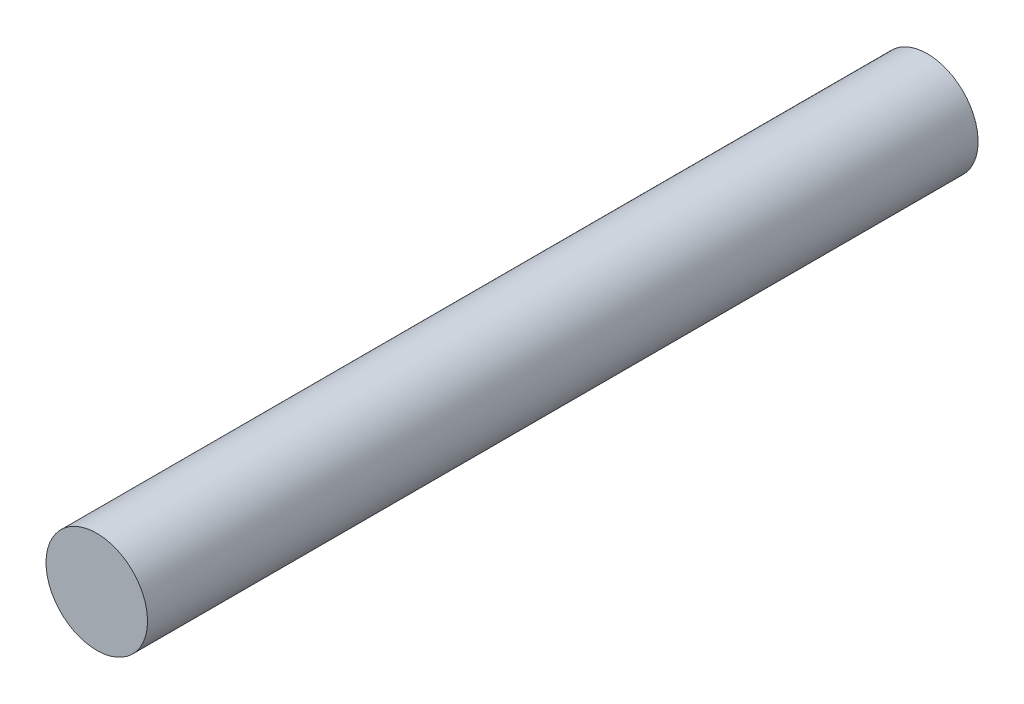
from build123d import *

# Parameters (mm, degrees)
CROQUIS1_R              = 2.75
SALIENTE_EXTRUIR1_DEPTH = 45


with BuildPart() as part:
    # Croquis1 → Saliente-Extruir1 (new body)
    with BuildSketch(Plane.XY):
        with Locations(Location((0, 0, 0), (0, 0, 180))):
            Circle(CROQUIS1_R)
    extrude(amount=SALIENTE_EXTRUIR1_DEPTH)


solid = part.part
